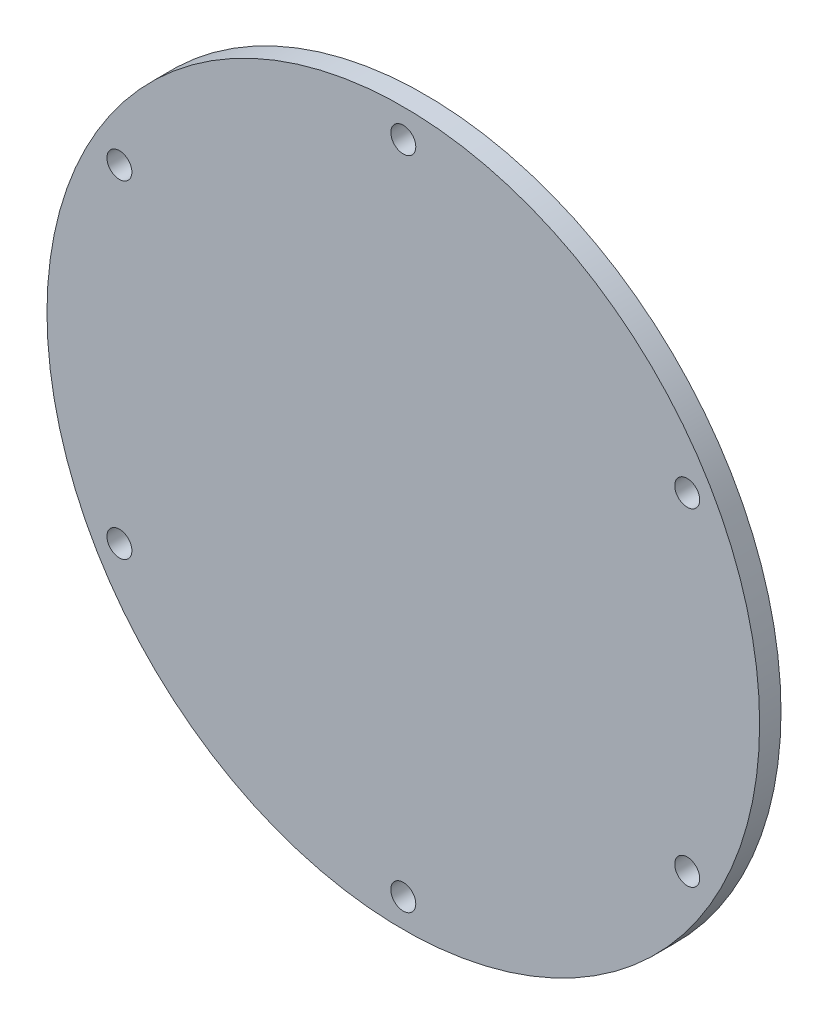
from build123d import *

# Parameters (mm, degrees)
SKETCH_1_R      = 50
SKETCH_1_R_2    = 1.75
EXTRUDE_1_DEPTH = 3


with BuildPart() as part:
    # Эскиз1 → Бобышка-Вытянуть1 (new body)
    with BuildSketch(Plane.XY):
        Circle(SKETCH_1_R)
        with Locations((0, 46)):
            Circle(SKETCH_1_R_2, mode=Mode.SUBTRACT)
        with Locations((39.837168574, 23)):
            Circle(SKETCH_1_R_2, mode=Mode.SUBTRACT)
        with Locations((39.837168574, -23)):
            Circle(SKETCH_1_R_2, mode=Mode.SUBTRACT)
        with Locations((0, -46)):
            Circle(SKETCH_1_R_2, mode=Mode.SUBTRACT)
        with Locations((-39.837168574, -23)):
            Circle(SKETCH_1_R_2, mode=Mode.SUBTRACT)
        with Locations((-39.837168574, 23)):
            Circle(SKETCH_1_R_2, mode=Mode.SUBTRACT)
    extrude(amount=EXTRUDE_1_DEPTH)


solid = part.part
